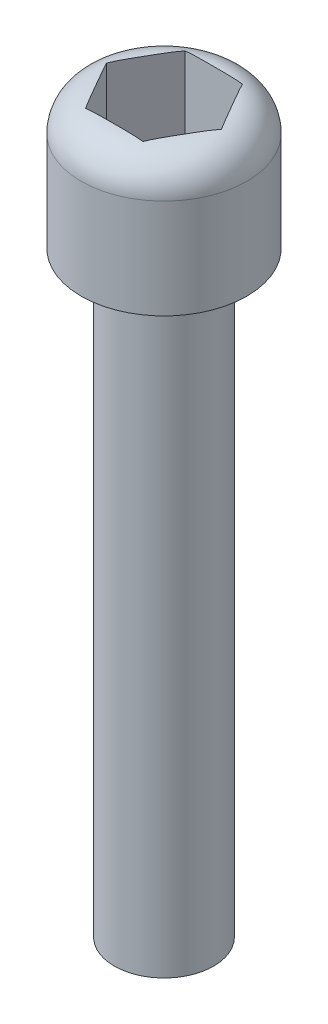
from build123d import *

# Parameters (mm, degrees)
SKETCH1_R           = 1.5
BOSS_EXTRUDE1_DEPTH = 18
SKETCH2_R           = 2.5
BOSS_EXTRUDE2_DEPTH = 4
FILLET2_R           = 1
CUT_EXTRUDE2_DEPTH  = 3


with BuildPart() as part:
    # Sketch1 → Boss-Extrude1 (new body)
    with BuildSketch(Plane(origin=(0, 0, 0), x_dir=(1, 0, 0), z_dir=(0, 1, 0))):
        with Locations(Location((0, 0, 0), (0, 0, 270))):
            Circle(SKETCH1_R)
    extrude(amount=BOSS_EXTRUDE1_DEPTH)

    # Sketch2 → Boss-Extrude2 (add)
    with BuildSketch(Plane(origin=(0, 18, 0), x_dir=(1, 0, 0), z_dir=(0, 1, 0))):
        with Locations(Location((0, 0, 0), (0, 0, 270))):
            Circle(SKETCH2_R)
    extrude(amount=BOSS_EXTRUDE2_DEPTH)

    # Fillet2
    fillet2_edges = [part.edges().sort_by_distance(p)[0] for p in [
        (0, 22, -2.5),
    ]]
    fillet(fillet2_edges, radius=FILLET2_R)

    # Sketch3 → Cut-Extrude2 (cut)
    with BuildSketch(Plane(origin=(0, 22, 0), x_dir=(1, 0, 0), z_dir=(0, 1, 0))):
        Polygon((1.732050808, 0), (0.866025404, 1.5), (-0.866025404, 1.5), (-1.732050808, 0), (-0.866025404, -1.5), (0.866025404, -1.5), align=None)
    extrude(amount=-CUT_EXTRUDE2_DEPTH, mode=Mode.SUBTRACT)


solid = part.part
